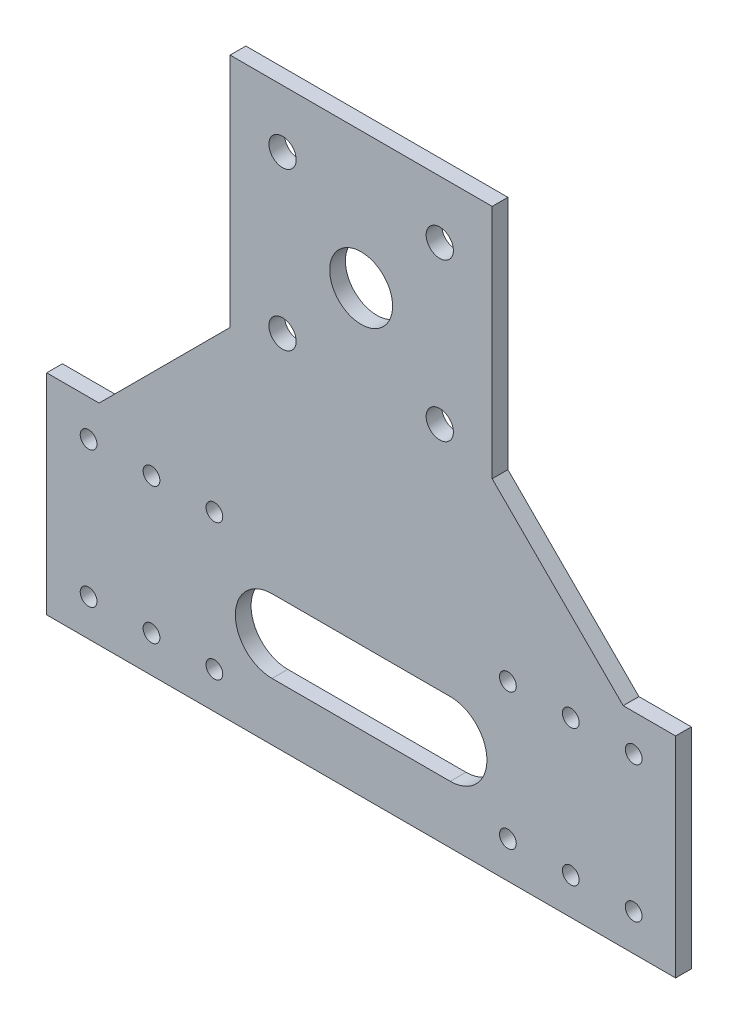
from build123d import *

# Parameters (mm, degrees)
EXTRUDE_1_DEPTH     = 3
SKETCH_2_R          = 2.6
SKETCH_2_R_2        = 1.6
SKETCH_2_R_3        = 6
CUT_EXTRUDE_1_DEPTH = 10


with BuildPart() as part:
    # 草图1 → 凸台-拉伸1 (new body)
    with BuildSketch(Plane.XY):
        Polygon((0, 0), (0, 40), (10, 40), (35, 65), (35, 110), (85, 110), (85, 65), (110, 40), (120, 40), (120, 0), align=None)
    extrude(amount=EXTRUDE_1_DEPTH)

    # 草图2 → 切除-拉伸1 (cut)
    with BuildSketch(Plane.XY.offset(3)):
        with Locations((45, 99)):
            Circle(SKETCH_2_R)
        with Locations((75, 99)):
            Circle(SKETCH_2_R)
        with Locations((75, 69)):
            Circle(SKETCH_2_R)
        with Locations((45, 69)):
            Circle(SKETCH_2_R)
        with Locations((8, 33)):
            Circle(SKETCH_2_R_2)
        with Locations((8, 7)):
            Circle(SKETCH_2_R_2)
        with Locations((112, 33)):
            Circle(SKETCH_2_R_2)
        with Locations((112, 7)):
            Circle(SKETCH_2_R_2)
        with Locations((20, 33)):
            Circle(SKETCH_2_R_2)
        with Locations((100, 33)):
            Circle(SKETCH_2_R_2)
        with Locations((20, 7)):
            Circle(SKETCH_2_R_2)
        with Locations((100, 7)):
            Circle(SKETCH_2_R_2)
        with Locations((32, 33)):
            Circle(SKETCH_2_R_2)
        with Locations((32, 7)):
            Circle(SKETCH_2_R_2)
        with Locations((88, 33)):
            Circle(SKETCH_2_R_2)
        with Locations((88, 7)):
            Circle(SKETCH_2_R_2)
        with Locations((60, 84)):
            Circle(SKETCH_2_R_3)
        with BuildLine():
            Line((43, 25), (77, 25))
            ThreePointArc((77, 25), (84, 18), (77, 11))
            Line((77, 11), (43, 11))
            ThreePointArc((43, 11), (36, 18), (43, 25))
        make_face()
    extrude(amount=-CUT_EXTRUDE_1_DEPTH, mode=Mode.SUBTRACT)


solid = part.part
